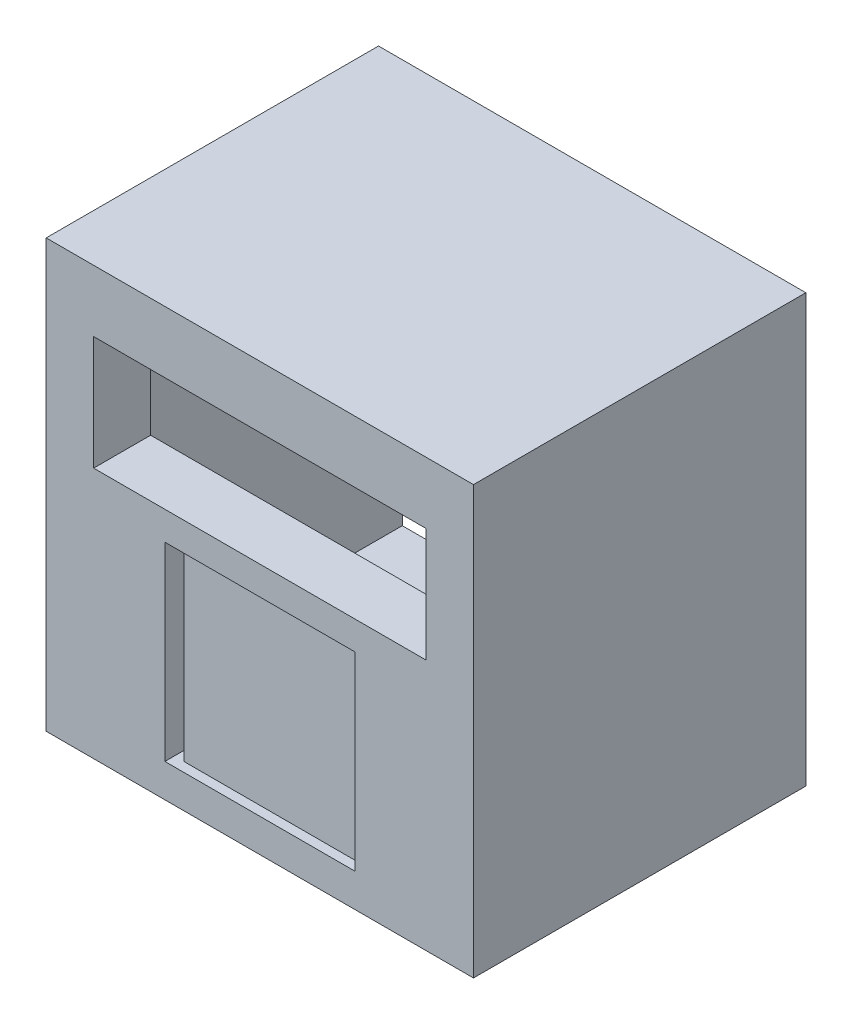
from build123d import *

# Parameters (mm, degrees)
SKETCH1_W           = 90
SKETCH1_H           = 90
BOSS_EXTRUDE1_DEPTH = 70
SHELL2_T            = -5
CUT_EXTRUDE1_REACH  = 96.604
SKETCH2_W           = 70
SKETCH2_H           = 24
BOSS_EXTRUDE2_DEPTH = 7
SKETCH5_W           = 40
SKETCH5_H           = 40
CUT_EXTRUDE2_DEPTH  = 2
CUT_EXTRUDE3_REACH  = 95.134
SKETCH6_W           = 2
SKETCH6_H           = 40


with BuildPart() as part:
    # Sketch1 → Boss-Extrude1 (new body)
    with BuildSketch(Plane.XY):
        Rectangle(SKETCH1_W, SKETCH1_H)
    extrude(amount=BOSS_EXTRUDE1_DEPTH)

    # Shell2
    shell2_openings = [part.faces().sort_by_distance(p)[0] for p in [
        (0, 0, 0),
    ]]
    offset(amount=SHELL2_T, openings=shell2_openings, kind=Kind.INTERSECTION)

    # Sketch2 → Cut-Extrude1 (cut, up to next)
    with BuildSketch(Plane.XY.offset(70), mode=Mode.PRIVATE) as cut_extrude1_sk1:
        with Locations((0, 20)):
            Rectangle(SKETCH2_W, SKETCH2_H)
    cut_extrude1_tool1 = extrude(cut_extrude1_sk1.sketch, amount=-CUT_EXTRUDE1_REACH, mode=Mode.PRIVATE) & part.part
    add(cut_extrude1_tool1.solids().sort_by_distance((0, 20, 70))[0], mode=Mode.SUBTRACT)

    # Sketch4 → Boss-Extrude2 (add)
    with BuildSketch(Plane(origin=(0, 0, 65), x_dir=(-1, 0, 0), z_dir=(0, 0, -1))):
        Polygon((-40, 38), (-40, 32), (-35, 32), (35, 32), (35, 8), (-35, 8), (-40, 8), (-40, 2), (40, 2), (40, 38), align=None)
    extrude(amount=BOSS_EXTRUDE2_DEPTH)

    # Sketch5 → Cut-Extrude2 (cut)
    with BuildSketch(Plane.XY.offset(70)):
        with Locations((0, -18)):
            Rectangle(SKETCH5_W, SKETCH5_H)
    extrude(amount=-CUT_EXTRUDE2_DEPTH, mode=Mode.SUBTRACT)

    # Sketch6 → Cut-Extrude3 (cut, up to next)
    with BuildSketch(Plane.XY.offset(68), mode=Mode.PRIVATE) as cut_extrude3_sk1:
        with Locations((-19, -18)):
            Rectangle(SKETCH6_W, SKETCH6_H)
    cut_extrude3_tool1 = extrude(cut_extrude3_sk1.sketch, amount=-CUT_EXTRUDE3_REACH, mode=Mode.PRIVATE) & part.part
    add(cut_extrude3_tool1.solids().sort_by_distance((-19, -18, 68))[0], mode=Mode.SUBTRACT)


solid = part.part
